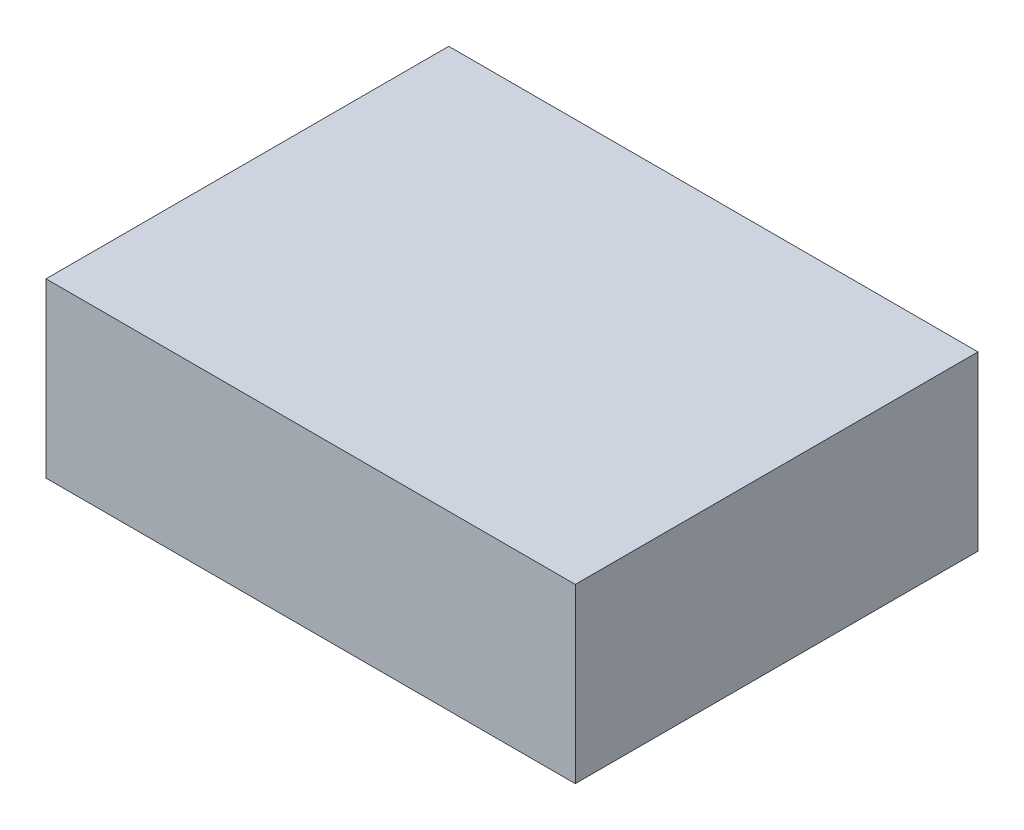
from build123d import *

# Parameters (mm, degrees)
ESBO_O1_W                = 46
ESBO_O1_H                = 35
RESSALTO_EXTRUS_O1_DEPTH = 15


with BuildPart() as part:
    # Esboço1 → Ressalto-extrusão1 (new body)
    with BuildSketch(Plane(origin=(0, 0, 0), x_dir=(1, 0, 0), z_dir=(0, 1, 0))):
        Rectangle(ESBO_O1_W, ESBO_O1_H)
    extrude(amount=RESSALTO_EXTRUS_O1_DEPTH)


solid = part.part
